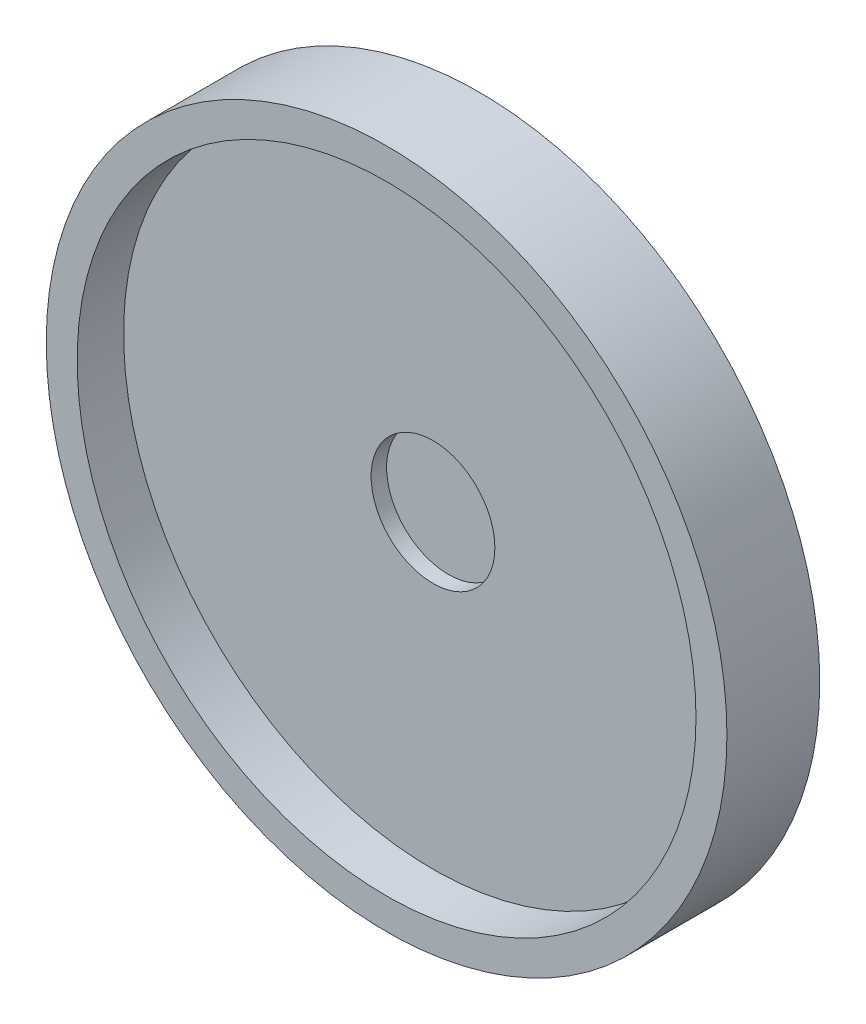
from build123d import *

# Parameters (mm, degrees)
ESBO_O1_R                = 20
ESBO_O1_R_2              = 4
RESSALTO_EXTRUS_O3_DEPTH = 3
ESBO_O1_6_R              = 22
ESBO_O1_6_R_2            = 20
RESSALTO_EXTRUS_O4_DEPTH = 6
ESBO_O1_7_R              = 4
RESSALTO_EXTRUS_O5_DEPTH = 2


with BuildPart() as part:
    # Esboço1 → Ressalto-extrusão3 (new body)
    with BuildSketch(Plane.XY):
        Circle(ESBO_O1_R)
        Circle(ESBO_O1_R_2, mode=Mode.SUBTRACT)
    extrude(amount=RESSALTO_EXTRUS_O3_DEPTH)

    # Esboço1<6> → Ressalto-extrusão4 (add)
    with BuildSketch(Plane.XY):
        Circle(ESBO_O1_6_R)
        Circle(ESBO_O1_6_R_2, mode=Mode.SUBTRACT)
    extrude(amount=RESSALTO_EXTRUS_O4_DEPTH)

    # Esboço1<7> → Ressalto-extrusão5 (add)
    with BuildSketch(Plane.XY):
        Circle(ESBO_O1_7_R)
    extrude(amount=RESSALTO_EXTRUS_O5_DEPTH)


solid = part.part
